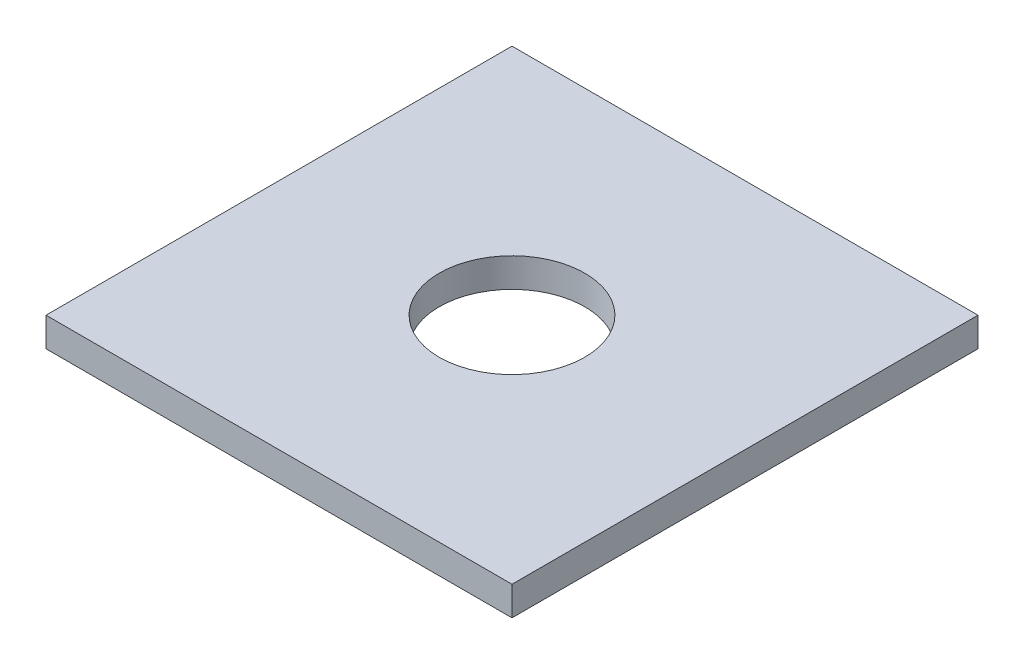
from build123d import *

# Parameters (mm, degrees)
SKETCH_1_W          = 16
SKETCH_1_H          = 16
EXTRUDE_1_DEPTH     = 1
SKETCH_2_R          = 2.5
CUT_EXTRUDE_1_DEPTH = 1


with BuildPart() as part:
    # 草图1 → 凸台-拉伸1 (new body)
    with BuildSketch(Plane(origin=(0, 0, 0), x_dir=(1, 0, 0), z_dir=(0, 1, 0))):
        Rectangle(SKETCH_1_W, SKETCH_1_H)
    extrude(amount=EXTRUDE_1_DEPTH)

    # 草图2 → 切除-拉伸1 (cut)
    with BuildSketch(Plane(origin=(0, 1, 0), x_dir=(1, 0, 0), z_dir=(0, 1, 0))):
        with Locations(Location((0, 0, 0), (0, 0, 270))):
            Circle(SKETCH_2_R)
    extrude(amount=-CUT_EXTRUDE_1_DEPTH, mode=Mode.SUBTRACT)


solid = part.part
